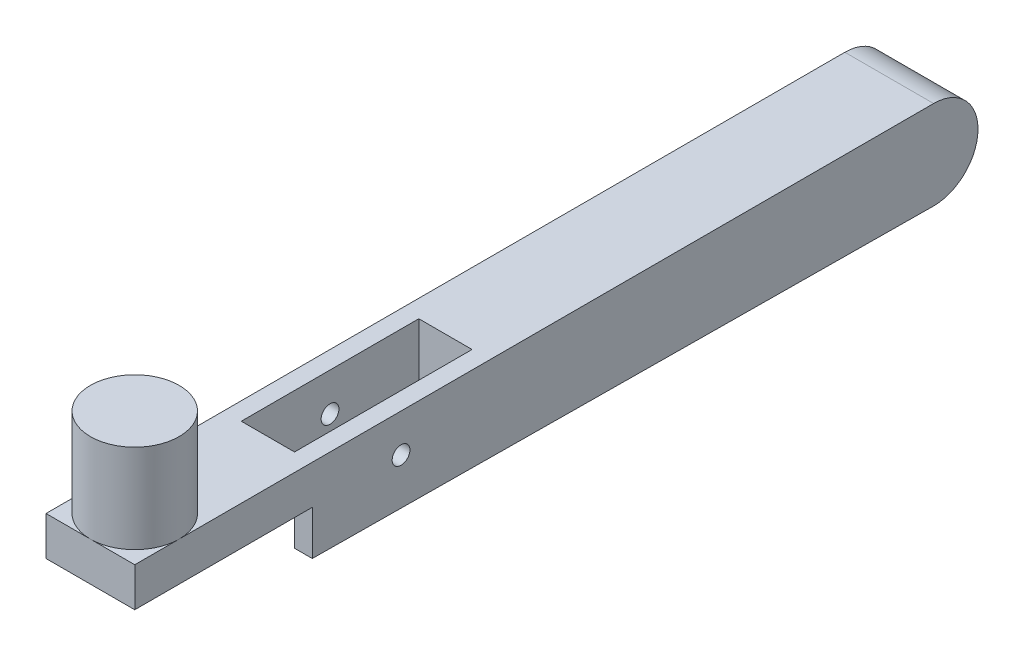
from build123d import *

# Parameters (mm, degrees)
BOSS_EXTRUDE1_DEPTH = 50
BOSS_EXTRUDE2_START = 35.418994
SKETCH2_R           = 25
BOSS_EXTRUDE2_DEPTH = 50
SKETCH4_W           = 30
SKETCH4_H           = 100
CUT_EXTRUDE1_DEPTH  = 318.853328976
SKETCH5_R           = 5
CUT_EXTRUDE2_DEPTH  = 326.310841007


with BuildPart() as part:
    # Sketch1 → Boss-Extrude1 (new body)
    with BuildSketch(Plane(origin=(0, 0, 0), x_dir=(0, 0, -1), z_dir=(1, 0, 0))):
        with BuildLine():
            Line((140.111731844, 35.418994413), (-209.888268156, 35.418994413))
            Line((-209.888268156, 35.418994413), (-309.888268156, 35.418994413))
            Line((-309.888268156, 35.418994413), (-309.888268156, 13.43575419))
            Line((-309.888268156, 13.43575419), (-209.888268156, 13.43575419))
            Line((-209.888268156, 13.43575419), (-209.888268156, -11.56424581))
            Line((-209.888268156, -11.56424581), (139.680798176, -14.577291234))
            ThreePointArc((139.680798176, -14.577291234), (115.112660449, 10.634469251), (140.111731844, 35.418994413))
        make_face()
        with BuildLine():
            Line((140.111731844, -14.581005587), (140.111731844, 35.418994413))
            ThreePointArc((140.111731844, 35.418994413), (115.112660449, 10.634469251), (139.680798176, -14.577291234))
            Line((139.680798176, -14.577291234), (140.111731844, -14.581005587))
        make_face()
        with BuildLine():
            ThreePointArc((165.111731844, 10.418994413), (157.789401373, 28.096663943), (140.111731844, 35.418994413))
            Line((140.111731844, 35.418994413), (140.111731844, -14.581005587))
            ThreePointArc((140.111731844, -14.581005587), (157.789401373, -7.258675116), (165.111731844, 10.418994413))
        make_face()
    extrude(amount=BOSS_EXTRUDE1_DEPTH)

    # Sketch2 → Boss-Extrude2 (add)
    with BuildSketch(Plane(origin=(0, 0, 0), x_dir=(1, 0, 0), z_dir=(0, 1, 0)).offset(BOSS_EXTRUDE2_START)):
        with Locations(Location((25, -284.888268156, 0), (0, 0, 270))):
            Circle(SKETCH2_R)
    extrude(amount=BOSS_EXTRUDE2_DEPTH)

    # Sketch4 → Cut-Extrude1 (cut, through all)
    with BuildSketch(Plane(origin=(0, 35.418994413, 0), x_dir=(1, 0, 0), z_dir=(0, 1, 0))):
        with Locations((25, -159.888268156)):
            Rectangle(SKETCH4_W, SKETCH4_H)
    extrude(amount=-CUT_EXTRUDE1_DEPTH, mode=Mode.SUBTRACT)

    # Sketch5 → Cut-Extrude2 (cut, through all)
    with BuildSketch(Plane(origin=(50, 0, 0), x_dir=(0, 0, -1), z_dir=(1, 0, 0))):
        with Locations((-159.888268156, 13.945126907)):
            Circle(SKETCH5_R)
    extrude(amount=-CUT_EXTRUDE2_DEPTH, mode=Mode.SUBTRACT)


solid = part.part
